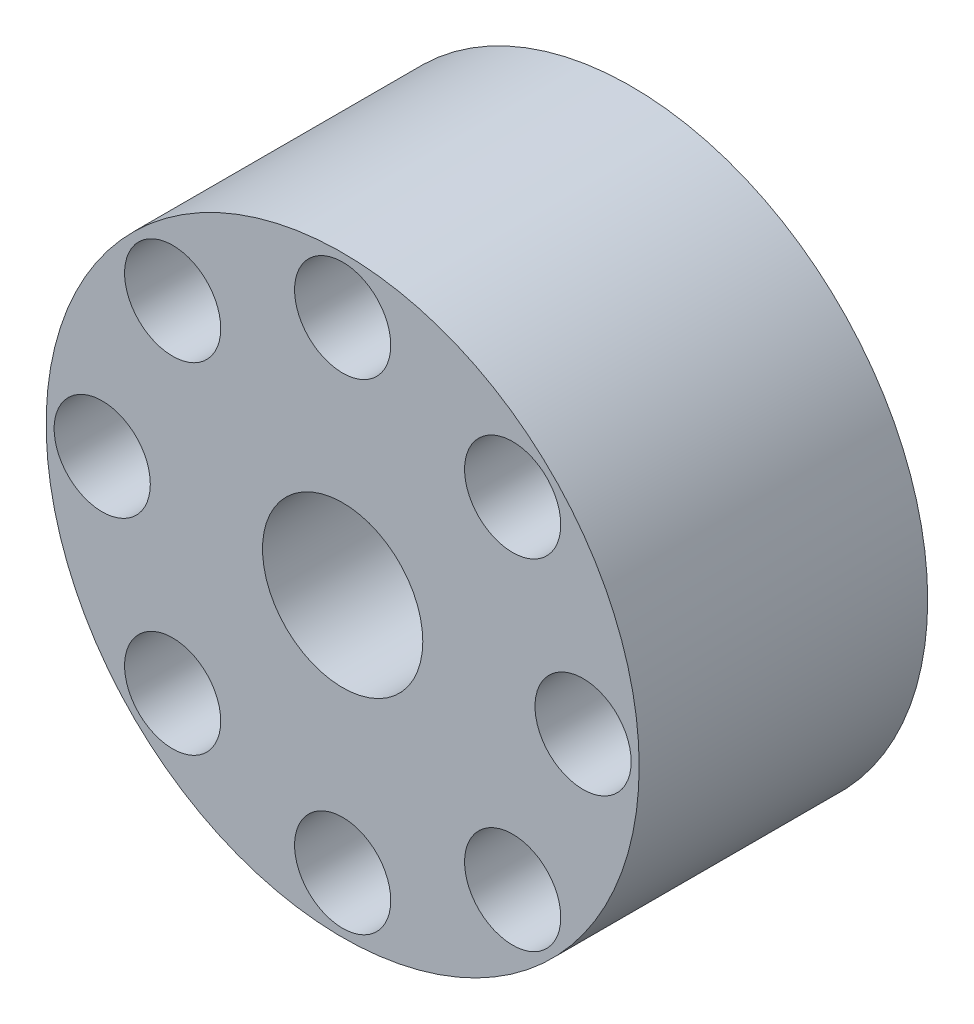
from build123d import *

# Parameters (mm, degrees)
SKETCH_1_R      = 18.5
SKETCH_1_R_2    = 3
SKETCH_1_R_3    = 5
EXTRUDE_1_DEPTH = 18


with BuildPart() as part:
    # 草图1 → 凸台-拉伸1 (new body)
    with BuildSketch(Plane.XY):
        Circle(SKETCH_1_R)
        with Locations((15, 0)):
            Circle(SKETCH_1_R_2, mode=Mode.SUBTRACT)
        with Locations((10.606601718, -10.606601718)):
            Circle(SKETCH_1_R_2, mode=Mode.SUBTRACT)
        with Locations((0, -15)):
            Circle(SKETCH_1_R_2, mode=Mode.SUBTRACT)
        with Locations((-10.606601718, -10.606601718)):
            Circle(SKETCH_1_R_2, mode=Mode.SUBTRACT)
        with Locations((-15, 0)):
            Circle(SKETCH_1_R_2, mode=Mode.SUBTRACT)
        with Locations((-10.606601718, 10.606601718)):
            Circle(SKETCH_1_R_2, mode=Mode.SUBTRACT)
        with Locations((0, 15)):
            Circle(SKETCH_1_R_2, mode=Mode.SUBTRACT)
        with Locations((10.606601718, 10.606601718)):
            Circle(SKETCH_1_R_2, mode=Mode.SUBTRACT)
        Circle(SKETCH_1_R_3, mode=Mode.SUBTRACT)
    extrude(amount=EXTRUDE_1_DEPTH)


solid = part.part
